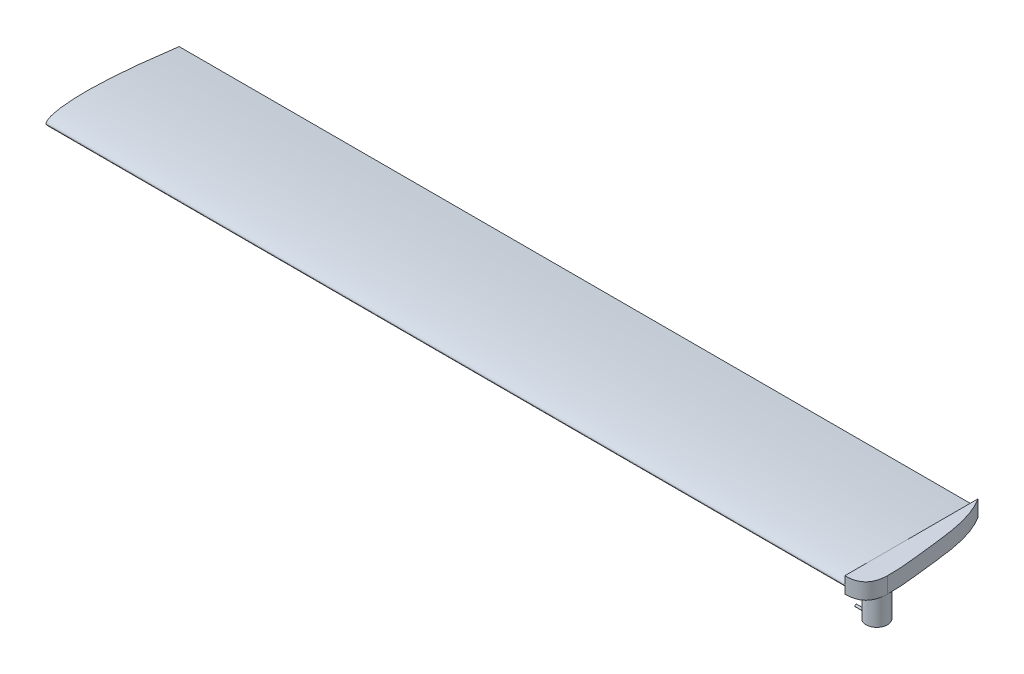
from build123d import *

# Parameters (mm, degrees)
BOSS_EXTRUDE1_DEPTH                  = 750
BOSS_EXTRUDE2_DEPTH                  = 15
SKETCH3_R                            = 10
BOSS_EXTRUDE4_DEPTH                  = 25
SKETCH4_R                            = 1
BOSS_EXTRUDE5_DEPTH                  = 9.5
BOSS_EXTRUDE5_DIRECTION_2_REACH      = 762.756
BOSS_EXTRUDE5_DIRECTION_2_END_RADIUS = 10
CUT_EXTRUDE1_DEPTH                   = 181
CUT_EXTRUDE1_DEPTH_BACK              = 181


with BuildPart() as part:
    # Sketch1 → Boss-Extrude1 (new body)
    with BuildSketch(Plane(origin=(0, 0, 0), x_dir=(0, 0, -1), z_dir=(1, 0, 0))):
        with BuildLine():
            Line((124.995841149, 7.69748541), (124.995841149, 7.355117962))
            add(Edge.make_bspline(
                [(124.995841149, 7.69748541), (121.54944134, 8.132970798), (115.70786567, 8.871109432), (106.612829463, 10.001168496), (98.776677449, 10.90008096), (91.010430983, 11.718079743), (84.466171166, 12.374421583), (77.123127033, 13.01089191), (70.096902966, 13.661558661), (63.232186969, 14.038262432), (56.951183357, 14.458646485), (50.183054312, 14.744779284), (43.713149432, 14.928847728), (38.016747366, 14.98676945), (31.867108518, 14.964167357), (25.961108401, 14.764171889), (20.418478368, 14.31892281), (16.080893919, 13.902077279), (11.948417441, 13.276680513), (7.872022134, 12.438747868), (4.55145991, 11.481590763), (1.935078283, 10.189615691), (0.419790589, 8.867752598), (-0.116328202, 7.676448045), (0.228543289, 6.575716308), (1.092059769, 5.382828043), (3.121329832, 4.182675807), (5.833945868, 3.122360161), (8.969424846, 2.338039739), (12.454934448, 1.635555066), (16.398041291, 1.057622245), (20.40737347, 0.619305342), (24.940496845, 0.318514105), (28.9969109, 0.097914693), (33.640357675, 0.064950819), (37.619824838, -0.008774002), (42.130231161, 0.0151669), (46.825478609, 0.12809962), (52.059229259, 0.308197083), (57.570273171, 0.566048003), (63.06655694, 0.903534981), (68.78158744, 1.273560104), (74.2410514, 1.701195853), (79.332078991, 2.13196813), (83.765135248, 2.525837795), (88.333862548, 3.014972175), (93.451881908, 3.495491212), (98.448514928, 4.030663182), (103.359945306, 4.559670893), (107.534749069, 5.051051401), (112.036034411, 5.652589328), (116.898948088, 6.205114514), (121.185254011, 6.89818955), (124.034905271, 7.135577505), (124.871587069, 7.326730223), (124.995841149, 7.355117962)],
                knots=[0, 0, 0, 0, 0.040909693, 0.069341075, 0.107932085, 0.133795715, 0.161307297, 0.185385504, 0.220597866, 0.244393633, 0.266343568, 0.294730889, 0.324163188, 0.342565083, 0.361815516, 0.396586444, 0.412117028, 0.427295281, 0.44789639, 0.461301181, 0.476284913, 0.488528163, 0.495261637, 0.499815717, 0.502760785, 0.508369898, 0.516837026, 0.529992215, 0.542688859, 0.55481219, 0.571870003, 0.589595674, 0.60229618, 0.625369139, 0.637420541, 0.65697654, 0.672241267, 0.69053398, 0.712285021, 0.733912638, 0.755503976, 0.777133729, 0.801356586, 0.819993044, 0.837303591, 0.853766864, 0.874103184, 0.897840615, 0.912945775, 0.932278219, 0.947341947, 0.966428856, 0.989896213, 0.998499505, 1, 1, 1, 1], degree=3))
        make_face()
    extrude(amount=BOSS_EXTRUDE1_DEPTH)

    # Sketch2 → Boss-Extrude2 (add)
    with BuildSketch(Plane(origin=(0, 0, 0), x_dir=(1, 0, 0), z_dir=(0, 1, 0))):
        with BuildLine():
            Line((0, 124.995841149), (0, -0.000123715))
            add(Edge.make_bspline(
                [(0, -0.000123715), (-19.650012377, -0.338073724), (-20, 19.999876285)],
                knots=[0, 0, 0, 1, 1, 1], degree=2))
            add(Edge.make_bspline(
                [(-20, 19.999876285), (-20.256491221, 33.605237108), (-15.141746561, 69.220975098), (-12.666672021, 105.011543662), (0, 124.995841149)],
                knots=[0, 0, 0, 0, 0.363918555, 1, 1, 1, 1], degree=3))
        make_face()
    extrude(amount=BOSS_EXTRUDE2_DEPTH)

    # Sketch3 → Boss-Extrude4 (add)
    with BuildSketch(Plane.XZ):
        with Locations(Location((-10, -19.999876285, 0), (0, 0, 177.405061506))):
            Circle(SKETCH3_R)
    extrude(amount=BOSS_EXTRUDE4_DEPTH)

    # Sketch4 → Boss-Extrude5 (add)
    with BuildSketch(Plane(origin=(0, 0, 0), x_dir=(0, 0, -1), z_dir=(1, 0, 0))):
        with Locations(Location((19.999876285, -24, 0), (0, 0, 90.00000003))):
            Circle(SKETCH4_R)
    extrude(amount=BOSS_EXTRUDE5_DEPTH)

    # Boss-Extrude5 direction 2: up to this cylinder (the profile starts outside it)
    boss_extrude5_direction_2_end = Plane(origin=(-10, -24, -19.999876285), z_dir=(0, 1, 0)) * Cylinder(BOSS_EXTRUDE5_DIRECTION_2_END_RADIUS, 1546.512, mode=Mode.PRIVATE)
    # Sketch4 → Boss-Extrude5 direction 2 (add, up to the surface)
    with BuildSketch(Plane(origin=(0, 0, 0), x_dir=(0, 0, -1), z_dir=(1, 0, 0)), mode=Mode.PRIVATE) as boss_extrude5_direction_2_sk1:
        with Locations(Location((19.999876285, -24, 0), (0, 0, 90.00000003))):
            Circle(SKETCH4_R)
    boss_extrude5_direction_2_tool1 = extrude(boss_extrude5_direction_2_sk1.sketch, amount=-BOSS_EXTRUDE5_DIRECTION_2_REACH, mode=Mode.PRIVATE) - boss_extrude5_direction_2_end
    add(boss_extrude5_direction_2_tool1.solids().sort_by_distance((0, -24, -19.999876))[0])
    add(boss_extrude5_direction_2_tool1.solids().sort_by_distance((0, -24, -19.999876))[1])

    # Mirror1: part across plane


with BuildPart() as part_1:
    add(part.part)
    add(part.part.mirror(Plane(origin=(375, 0, 0), x_dir=(0, 0, 1), z_dir=(1, 0, 0))))

    # Sketch5 → Cut-Extrude1 (cut, two sides: drawn at the far end of the back side and taken through both)
    with BuildSketch(Plane.XY.offset(-CUT_EXTRUDE1_DEPTH_BACK)):
        Polygon((0, 15), (0, -13.108263075), (13.657066772, -13.108263075), (13.657066772, -35.248255002), (-23.943813373, -35.248255002), (-23.943813373, 21.27675232), (0, 21.27675232), align=None)
    extrude(amount=CUT_EXTRUDE1_DEPTH + CUT_EXTRUDE1_DEPTH_BACK, mode=Mode.SUBTRACT)


solid = part_1.part
